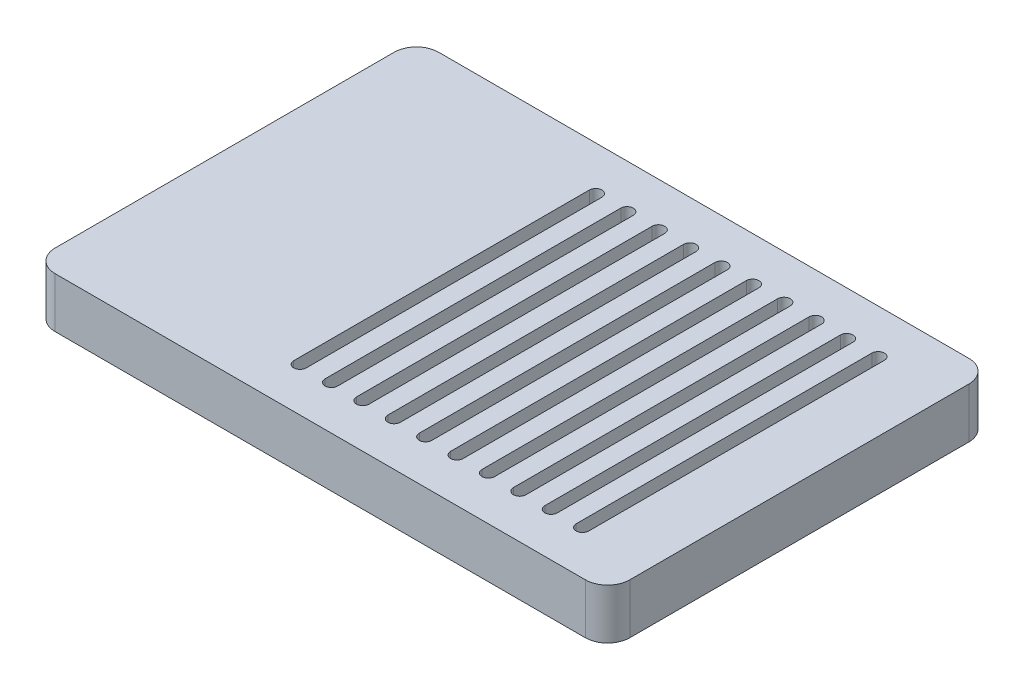
from build123d import *

# Parameters (mm, degrees)
SKETCH1_W           = 91.55
SKETCH1_H           = 61.1
BOSS_EXTRUDE1_DEPTH = 8
SKETCH2_W           = 89.55
SKETCH2_H           = 59.1
CUT_EXTRUDE1_DEPTH  = 6
CUT_EXTRUDE2_REACH  = 189.594
SKETCH3_W           = 13.7
SKETCH3_H           = 5.15
CUT_EXTRUDE3_REACH  = 189.594
SKETCH4_W           = 13.7
SKETCH4_H           = 5.15
CUT_EXTRUDE4_REACH  = 189.594
FILLET1_R           = 2
FILLET2_R           = 3.55
CUT_EXTRUDE5_DEPTH  = 2
LPATTERN1_COUNT     = 10
LPATTERN1_PITCH     = 5


with BuildPart() as part:
    # Sketch1 → Boss-Extrude1 (new body)
    with BuildSketch(Plane(origin=(0, 22.1, -139.373711609), x_dir=(1, 0, 0), z_dir=(0, 1, 0))):
        with Locations((0.725, -131.69)):
            Rectangle(SKETCH1_W, SKETCH1_H)
    extrude(amount=-BOSS_EXTRUDE1_DEPTH)

    # Sketch2 → Cut-Extrude1 (cut)
    with BuildSketch(Plane(origin=(0, 14.1, -139.373711609), x_dir=(1, 0, 0), z_dir=(0, -1, 0))):
        with Locations((0.725, 131.69)):
            Rectangle(SKETCH2_W, SKETCH2_H)
    extrude(amount=-CUT_EXTRUDE1_DEPTH, mode=Mode.SUBTRACT)

    # Sketch3 → Cut-Extrude2 (cut, up to next)
    with BuildSketch(Plane(origin=(-45.05, 0, -139.373711609), x_dir=(0, 0, 1), z_dir=(-1, 0, 0)), mode=Mode.PRIVATE) as cut_extrude2_sk1:
        with Locations((150.705690784, 16.675)):
            Rectangle(SKETCH3_W, SKETCH3_H)
    cut_extrude2_tool1 = extrude(cut_extrude2_sk1.sketch, amount=-CUT_EXTRUDE2_REACH, mode=Mode.PRIVATE) & part.part
    add(cut_extrude2_tool1.solids().sort_by_distance((-45.05, 16.675, 11.331979))[0], mode=Mode.SUBTRACT)

    # Sketch4 → Cut-Extrude3 (cut, up to next)
    with BuildSketch(Plane(origin=(-45.05, 0, -139.373711609), x_dir=(0, 0, 1), z_dir=(-1, 0, 0)), mode=Mode.PRIVATE) as cut_extrude3_sk1:
        with Locations((132.305690784, 16.675)):
            Rectangle(SKETCH4_W, SKETCH4_H)
    cut_extrude3_tool1 = extrude(cut_extrude3_sk1.sketch, amount=-CUT_EXTRUDE3_REACH, mode=Mode.PRIVATE) & part.part
    add(cut_extrude3_tool1.solids().sort_by_distance((-45.05, 16.675, -7.068021))[0], mode=Mode.SUBTRACT)

    # Sketch5 → Cut-Extrude4 (cut, up to next)
    with BuildSketch(Plane(origin=(-45.05, 0, -139.373711609), x_dir=(0, 0, 1), z_dir=(-1, 0, 0)), mode=Mode.PRIVATE) as cut_extrude4_sk1:
        with BuildLine():
            Line((106.718199777, 14.1), (120.891183123, 14.1))
            ThreePointArc((120.891183123, 14.1), (120.179436321, 15.18113883), (118.95469145, 15.6))
            Line((118.95469145, 15.6), (108.65469145, 15.6))
            ThreePointArc((108.65469145, 15.6), (107.429946578, 15.18113883), (106.718199777, 14.1))
        make_face()
    cut_extrude4_tool1 = extrude(cut_extrude4_sk1.sketch, amount=-CUT_EXTRUDE4_REACH, mode=Mode.PRIVATE) & part.part
    add(cut_extrude4_tool1.solids().sort_by_distance((-45.05, 14.822712, -25.56902))[0], mode=Mode.SUBTRACT)

    # Fillet1
    fillet1_edges = [part.edges().sort_by_distance(p)[0] for p in [
        (-44.05, 17.1, 21.866288391),
        (45.5, 17.1, 21.866288391),
        (45.5, 17.1, -37.233711609),
        (-44.05, 17.1, -37.233711609),
        (-44.55, 19.25, 18.181979175),
        (-44.55, 19.25, 4.481979175),
        (-44.55, 19.25, -0.218020825),
        (-44.55, 19.25, -13.918020825),
    ]]
    fillet(fillet1_edges, radius=FILLET1_R)

    # Fillet2
    fillet2_edges = [part.edges().sort_by_distance(p)[0] for p in [
        (-45.05, 18.1, 22.866288391),
        (-45.05, 18.1, -38.233711609),
        (46.5, 18.1, -38.233711609),
        (46.5, 18.1, 22.866288391),
    ]]
    fillet(fillet2_edges, radius=FILLET2_R)

    # Sketch6 → Cut-Extrude5 (cut)
    with BuildSketch(Plane(origin=(0, 22.1, 0), x_dir=(1, 0, 0), z_dir=(0, 1, 0))):
        with BuildLine():
            Line((36.5, 31.233711609), (36.5, -15.866288391))
            ThreePointArc((36.5, -15.866288391), (35.5, -16.866288391), (34.5, -15.866288391))
            Line((34.5, -15.866288391), (34.5, 31.233711609))
            ThreePointArc((34.5, 31.233711609), (35.5, 32.233711609), (36.5, 31.233711609))
        make_face()
    cut_extrude5 = extrude(amount=-CUT_EXTRUDE5_DEPTH, mode=Mode.SUBTRACT)

    # LPattern1: Cut-Extrude5 ×10
    with Locations(*[(-i * LPATTERN1_PITCH, 0, 0) for i in range(1, LPATTERN1_COUNT)]):
        add(cut_extrude5, mode=Mode.SUBTRACT)


solid = part.part
